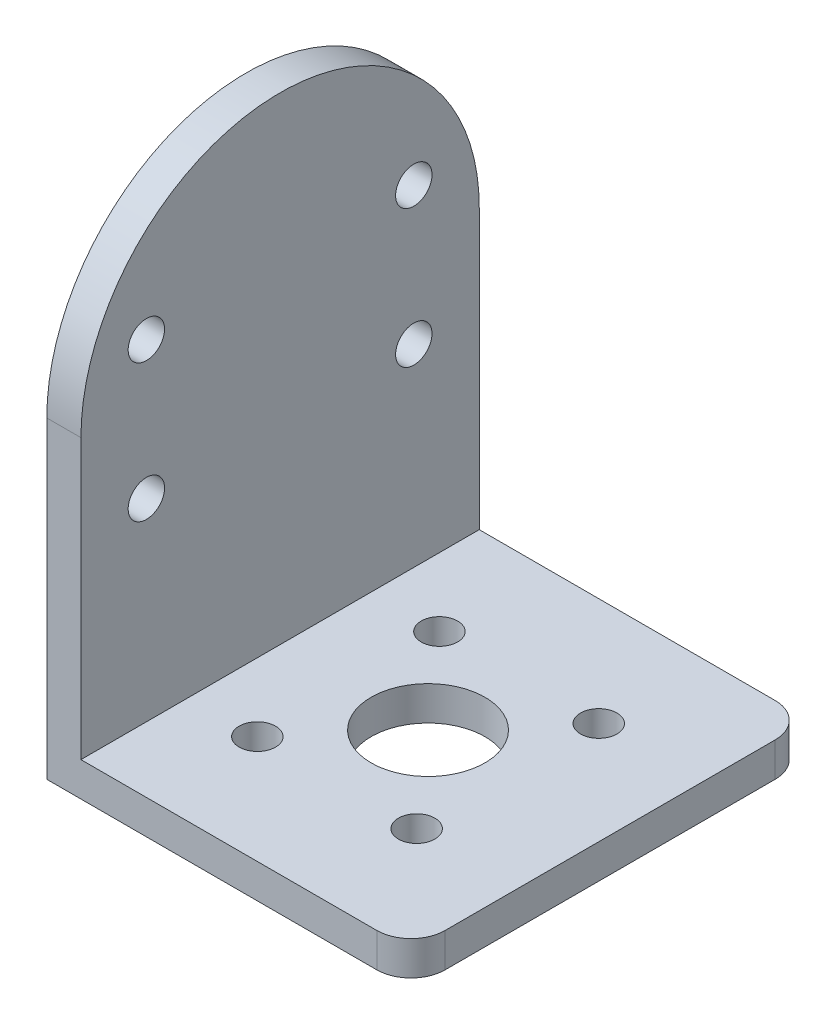
from build123d import *

# Parameters (mm, degrees)
EXTRUDE_1_DEPTH     = 17.5
SKETCH_2_R          = 1.6
CUT_EXTRUDE_2_DEPTH = 26
SKETCH_3_R          = 5
SKETCH_3_R_2        = 1.6
CUT_EXTRUDE_3_DEPTH = 56.625983137
FILLET_2_R          = 3


with BuildPart() as part:
    # 草图1 → 凸台-拉伸1 (new, symmetric)
    with BuildSketch(Plane.XY):
        Polygon((0, 0), (0, 45), (3, 45), (3, 3), (32, 3), (32, 0), align=None)
    extrude(amount=EXTRUDE_1_DEPTH, both=True)

    # 草图2 → 切除-拉伸2 (cut)
    with BuildSketch(Plane(origin=(3, 0, 0), x_dir=(0, 0, -1), z_dir=(1, 0, 0))):
        with BuildLine():
            Line((17.5, 27.5), (17.5, 45))
            Line((17.5, 45), (3.9e-08, 45))
            ThreePointArc((3.9e-08, 45), (12.374368684, 39.874368657), (17.5, 27.5))
        make_face()
        with BuildLine():
            ThreePointArc((-17.5, 27.5), (-12.374368657, 39.874368684), (3.9e-08, 45))
            Line((3.9e-08, 45), (-17.5, 45))
            Line((-17.5, 45), (-17.5, 27.5))
        make_face()
        with Locations(Location((-11.75, 20, 0), (0, 0, 90))):
            Circle(SKETCH_2_R)
        with Locations(Location((11.75, 20, 0), (0, 0, 90))):
            Circle(SKETCH_2_R)
        with Locations(Location((-11.75, 32.09, 0), (0, 0, 90))):
            Circle(SKETCH_2_R)
        with Locations(Location((11.75, 32.09, 0), (0, 0, 90))):
            Circle(SKETCH_2_R)
    extrude(amount=-CUT_EXTRUDE_2_DEPTH, mode=Mode.SUBTRACT)

    # 草图3 → 切除-拉伸3 (cut, through all)
    with BuildSketch(Plane(origin=(0, 3, 0), x_dir=(1, 0, 0), z_dir=(0, 1, 0))):
        with Locations(Location((16, 0, 0), (0, 0, 270))):
            Circle(SKETCH_3_R)
        with Locations(Location((9, 8, 0), (0, 0, 270))):
            Circle(SKETCH_3_R_2)
        with Locations(Location((23, 8, 0), (0, 0, 270))):
            Circle(SKETCH_3_R_2)
        with Locations(Location((23, -8, 0), (0, 0, 270))):
            Circle(SKETCH_3_R_2)
        with Locations(Location((9, -8, 0), (0, 0, 270))):
            Circle(SKETCH_3_R_2)
    extrude(amount=-CUT_EXTRUDE_3_DEPTH, mode=Mode.SUBTRACT)

    # 圆角2
    fillet_2_edges = [part.edges().sort_by_distance(p)[0] for p in [
        (32, 1.5, -17.5),
        (32, 1.5, 17.5),
    ]]
    fillet(fillet_2_edges, radius=FILLET_2_R)


solid = part.part
